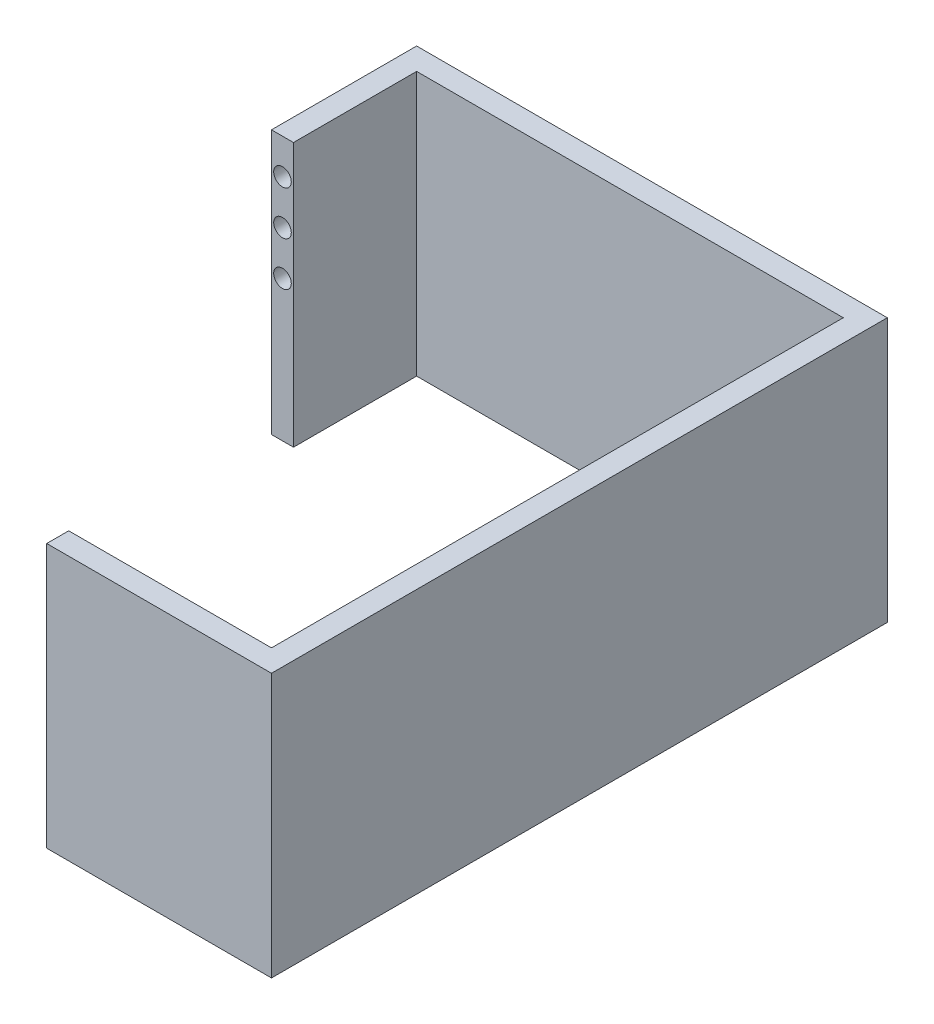
from build123d import *

# Parameters (mm, degrees)
BOSS_EXTRUDE1_DEPTH = 76.2
SKETCH4_R           = 2.54
CUT_EXTRUDE2_DEPTH  = 25.4
SKETCH6_R           = 2.54
CUT_EXTRUDE4_DEPTH  = 25.4


with BuildPart() as part:
    # Sketch1 → Boss-Extrude1 (new body)
    with BuildSketch(Plane(origin=(0, 0, 0), x_dir=(1, 0, 0), z_dir=(0, 1, 0))):
        Polygon((37.11256121, 167.224507406), (-98.77743879, 167.224507406), (-98.77743879, 125.314507406), (-92.42743879, 125.314507406), (-92.42743879, 160.874507406), (30.76256121, 160.874507406), (30.76256121, -4.225492594), (-27.78443879, -4.225492594), (-27.78443879, -10.575492594), (37.11256121, -10.575492594), align=None)
    extrude(amount=BOSS_EXTRUDE1_DEPTH)

    # Sketch4 → Cut-Extrude2 (cut)
    with BuildSketch(Plane.ZY.offset(27.78443879)):
        with Locations((7.400492594, 66.04)):
            Circle(SKETCH4_R)
        with Locations((7.400492594, 53.34)):
            Circle(SKETCH4_R)
        with Locations((7.400492594, 40.64)):
            Circle(SKETCH4_R)
    extrude(amount=-CUT_EXTRUDE2_DEPTH, mode=Mode.SUBTRACT)

    # Sketch6 → Cut-Extrude4 (cut)
    with BuildSketch(Plane.XY.offset(-125.314507406)):
        with Locations((-95.60243879, 66.04)):
            Circle(SKETCH6_R)
        with Locations((-95.60243879, 53.34)):
            Circle(SKETCH6_R)
        with Locations((-95.60243879, 40.64)):
            Circle(SKETCH6_R)
    extrude(amount=-CUT_EXTRUDE4_DEPTH, mode=Mode.SUBTRACT)


solid = part.part
